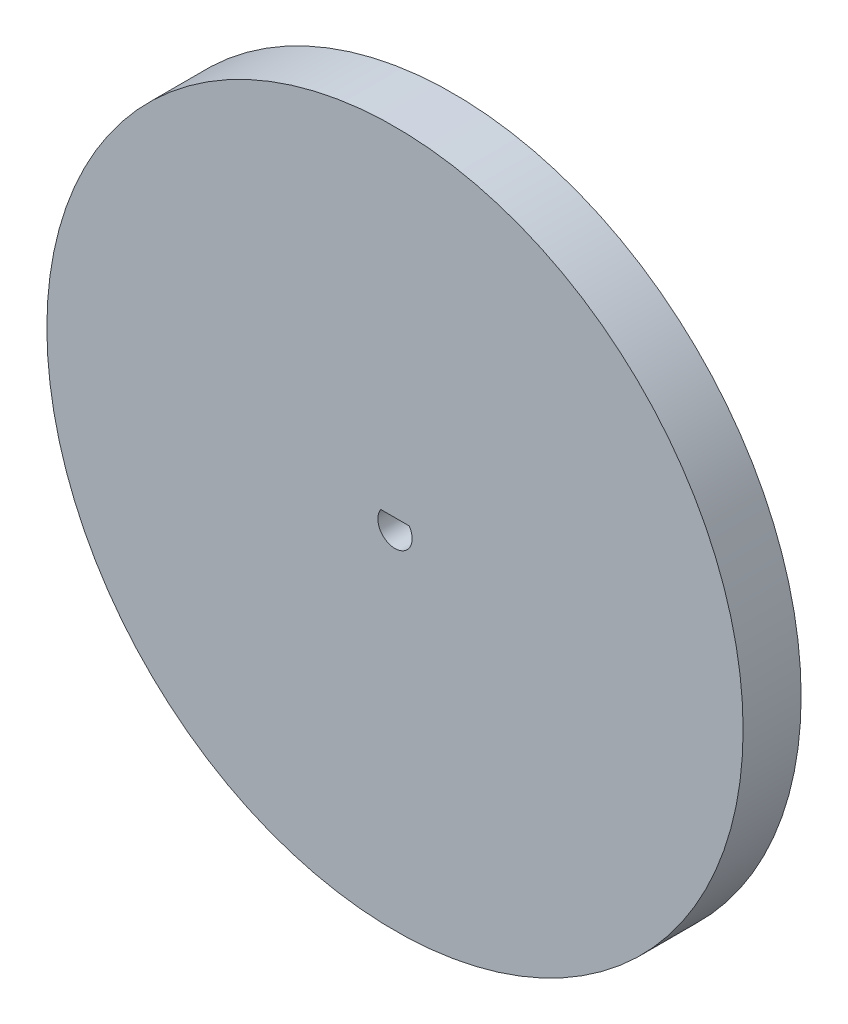
from build123d import *

# Parameters (mm, degrees)
SKETCH1_R           = 76.2
BOSS_EXTRUDE1_DEPTH = 6.35
CUT_EXTRUDE1_DEPTH  = 109.508847566


with BuildPart() as part:
    # Sketch1 → Boss-Extrude1 (new, symmetric)
    with BuildSketch(Plane.XY):
        Circle(SKETCH1_R)
    extrude(amount=BOSS_EXTRUDE1_DEPTH, both=True)

    # Sketch2 → Cut-Extrude1 (cut, through all)
    with BuildSketch(Plane.XY.offset(6.35)):
        with BuildLine():
            Line((-3.106847277, 2.1), (3.106847277, 2.1))
            ThreePointArc((3.106847277, 2.1), (0, -3.75), (-3.106847277, 2.1))
        make_face()
    extrude(amount=-CUT_EXTRUDE1_DEPTH, mode=Mode.SUBTRACT)


solid = part.part
